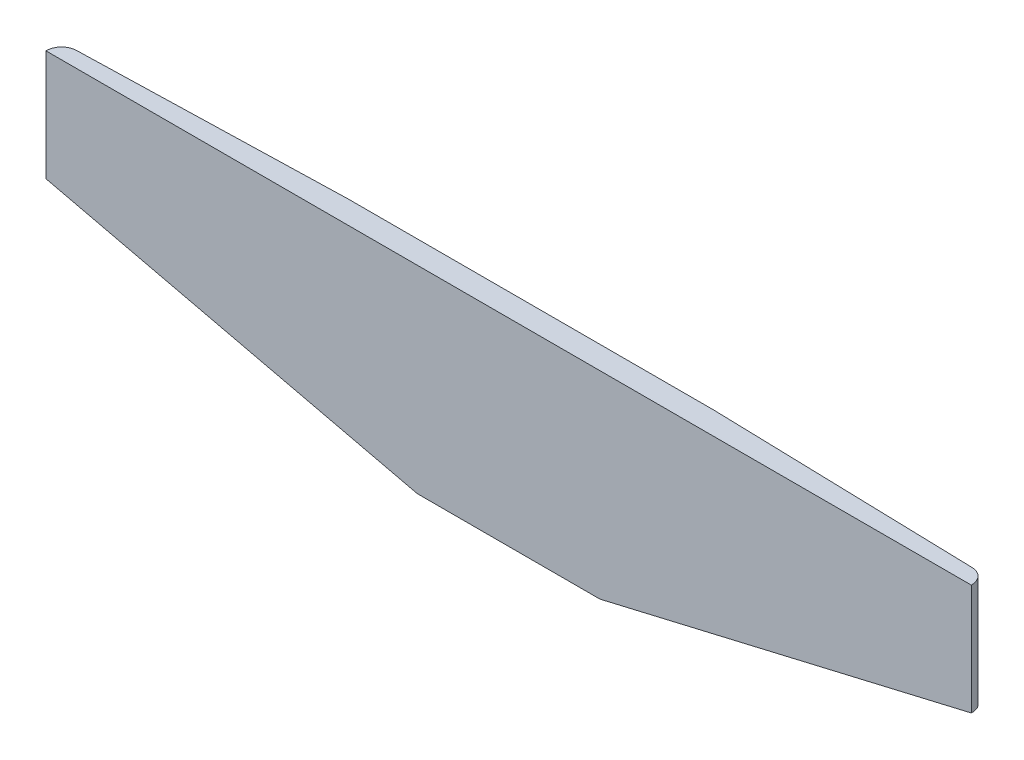
from build123d import *

# Parameters (mm, degrees)
BOSS_EXTRUDE1_DEPTH = 82.55
SKETCH1_OUTSIDE_W   = 467.064
SKETCH1_OUTSIDE_H   = 163.534
CUT_EXTRUDE1_DEPTH  = 395.921504257
FILLET2_R           = 6.35
FILLET3_R           = 6.35


with BuildPart() as part:
    # Sketch2 → Boss-Extrude1 (new body)
    with BuildSketch(Plane(origin=(0, 0, 0), x_dir=(1, 0, 0), z_dir=(0, 1, 0))):
        Polygon((193.04, 9.525), (193.04, 0), (386.08, 0), (386.08, 6.35), (269.24, 9.525), align=None)
        Polygon((0, 6.35), (0, 0), (193.04, 0), (193.04, 9.525), (116.84, 9.525), align=None)
    extrude(amount=-BOSS_EXTRUDE1_DEPTH)

    # Sketch1 outside → Cut-Extrude1 (cut, through all)
    with BuildSketch(Plane.XY):
        with Locations((193.04, -41.275)):
            Rectangle(SKETCH1_OUTSIDE_W, SKETCH1_OUTSIDE_H)
        Polygon((0, 0), (386.08, 0), (386.08, -46.228), (231.14, -82.55), (154.94, -82.55), (0, -46.228), align=None, mode=Mode.SUBTRACT)
    extrude(amount=-CUT_EXTRUDE1_DEPTH, mode=Mode.SUBTRACT)

    # Fillet2
    fillet2_edges = [part.edges().sort_by_distance(p)[0] for p in [
        (386.08, -23.114, -6.35),
    ]]
    fillet(fillet2_edges, radius=FILLET2_R)

    # Fillet3
    fillet3_edges = [part.edges().sort_by_distance(p)[0] for p in [
        (0, -23.114, -6.35),
    ]]
    fillet(fillet3_edges, radius=FILLET3_R)


solid = part.part
